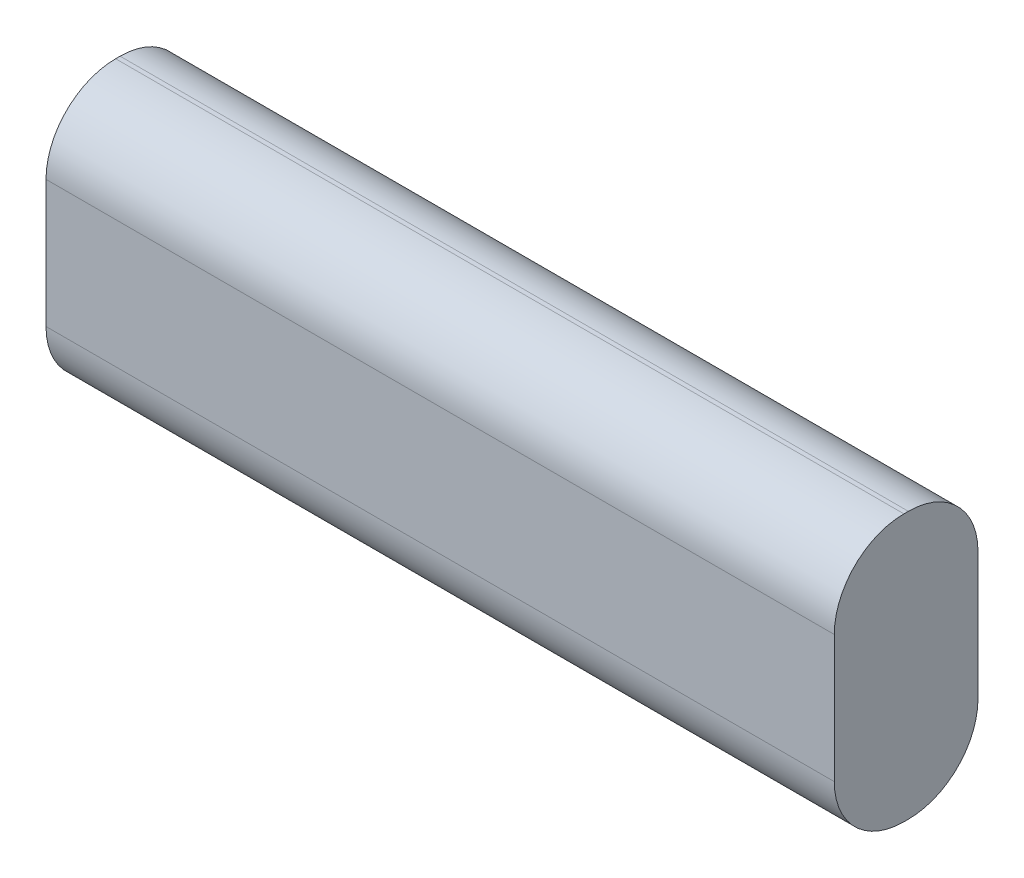
from build123d import *

# Parameters (mm, degrees)
SKETCH1_W           = 133
SKETCH1_H           = 45
BOSS_EXTRUDE1_DEPTH = 24.25
FILLET1_R           = 11.75


with BuildPart() as part:
    # Sketch1 → Boss-Extrude1 (new body)
    with BuildSketch(Plane.XY):
        with Locations((66.5, -22.5)):
            Rectangle(SKETCH1_W, SKETCH1_H)
    extrude(amount=BOSS_EXTRUDE1_DEPTH)

    # Fillet1
    fillet1_edges = [part.edges().sort_by_distance(p)[0] for p in [
        (66.5, 0, 24.25),
        (66.5, 0, 0),
        (66.5, -45, 0),
        (66.5, -45, 24.25),
    ]]
    fillet(fillet1_edges, radius=FILLET1_R)


solid = part.part
